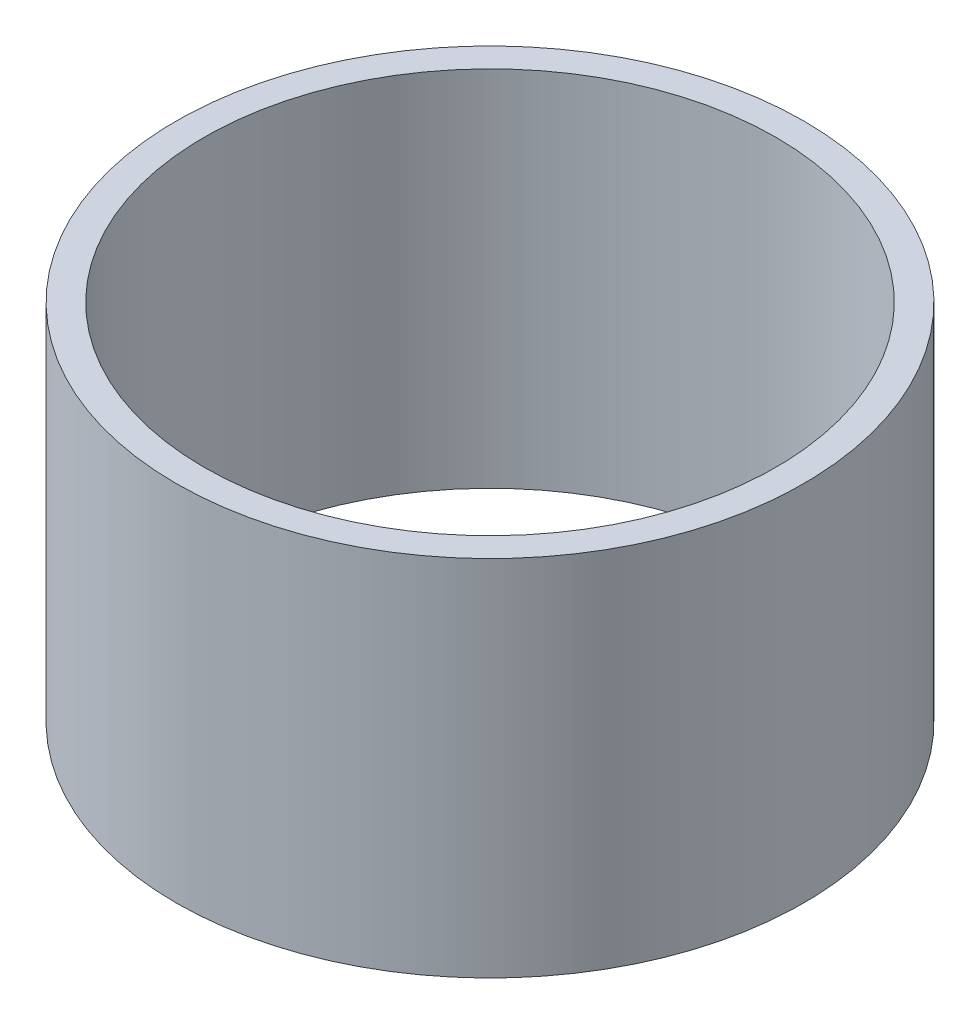
from build123d import *

# Parameters (mm, degrees)
SKETCH_1_R      = 14
SKETCH_1_R_2    = 12.75
EXTRUDE_1_DEPTH = 16.2


with BuildPart() as part:
    # 草图1 → 凸台-拉伸1 (new body)
    with BuildSketch(Plane(origin=(0, 0, 0), x_dir=(1, 0, 0), z_dir=(0, 1, 0))):
        with Locations(Location((0, 0, 0), (0, 0, 270))):
            Circle(SKETCH_1_R)
        with Locations(Location((0, 0, 0), (0, 0, 270))):
            Circle(SKETCH_1_R_2, mode=Mode.SUBTRACT)
    extrude(amount=EXTRUDE_1_DEPTH)


solid = part.part
